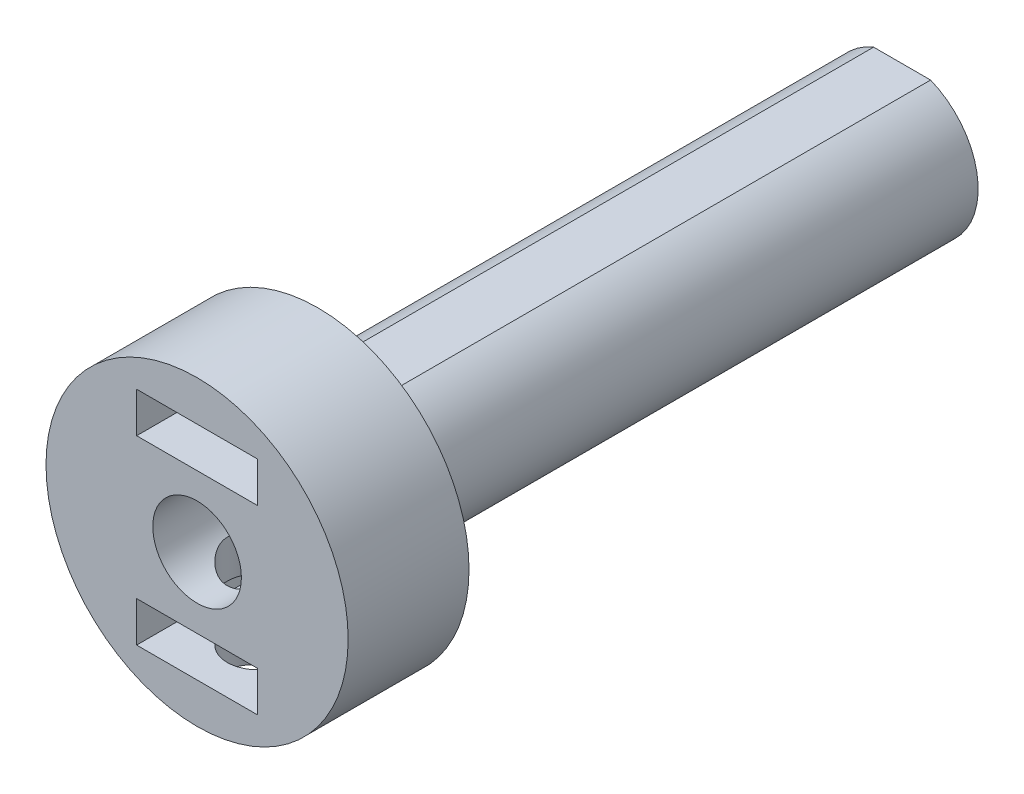
from build123d import *

# Parameters (mm, degrees)
SKETCH1_R           = 3.775
SKETCH1_R_2         = 2.2
BOSS_EXTRUDE1_DEPTH = 35
BOSS_EXTRUDE2_START = -6
SKETCH2_R           = 7.5
SKETCH2_R_2         = 3.775
BOSS_EXTRUDE2_DEPTH = 6
SKETCH3_W           = 6
SKETCH3_H           = 2
CUT_EXTRUDE1_DEPTH  = 37.571847096
SKETCH4_R           = 1.5
CUT_EXTRUDE2_DEPTH  = 37.571847096


with BuildPart() as part:
    # Sketch1 → Boss-Extrude1 (new body)
    with BuildSketch(Plane.XY):
        Circle(SKETCH1_R)
        Circle(SKETCH1_R_2, mode=Mode.SUBTRACT)
    extrude(amount=BOSS_EXTRUDE1_DEPTH)

    # Sketch2 → Boss-Extrude2 (add)
    with BuildSketch(Plane.XY.offset(35).offset(BOSS_EXTRUDE2_START)):
        Circle(SKETCH2_R)
        Circle(SKETCH2_R_2, mode=Mode.SUBTRACT)
    extrude(amount=BOSS_EXTRUDE2_DEPTH)

    # Sketch3 → Cut-Extrude1 (cut, through all)
    with BuildSketch(Plane.XY.offset(35)):
        with Locations((0, 4.5)):
            Rectangle(SKETCH3_W, SKETCH3_H)
        with Locations((0, -4.5)):
            Rectangle(SKETCH3_W, SKETCH3_H)
    extrude(amount=-CUT_EXTRUDE1_DEPTH, mode=Mode.SUBTRACT)

    # Sketch4 → Cut-Extrude2 (cut, through all)
    with BuildSketch(Plane(origin=(0, 0, 0), x_dir=(1, 0, 0), z_dir=(0, 1, 0))):
        with Locations(Location((0, -32, 0), (0, 0, 270))):
            Circle(SKETCH4_R)
    extrude(amount=-CUT_EXTRUDE2_DEPTH, mode=Mode.SUBTRACT)


solid = part.part
